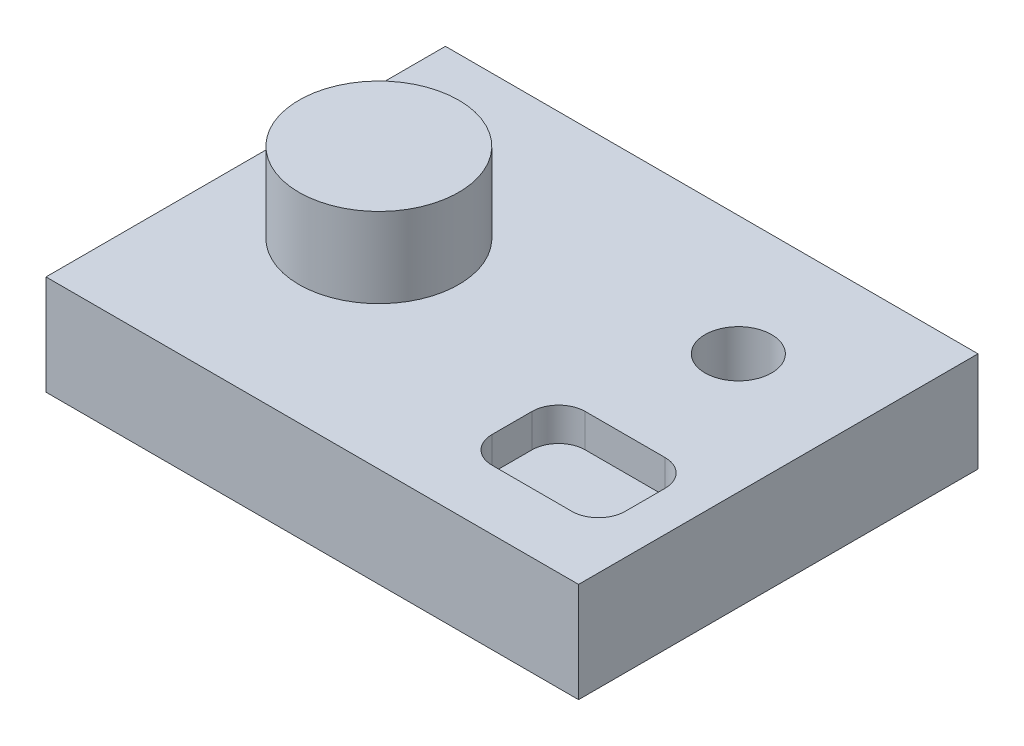
from build123d import *

# Parameters (mm, degrees)
SKETCH1_W           = 80
SKETCH1_H           = 60
BOSS_EXTRUDE1_DEPTH = 15
SKETCH2_R           = 12
BOSS_EXTRUDE2_DEPTH = 12
SKETCH3_R           = 5
CUT_EXTRUDE2_DEPTH  = 10
CUT_EXTRUDE4_DEPTH  = 5


with BuildPart() as part:
    # Sketch1 → Boss-Extrude1 (new body)
    with BuildSketch(Plane(origin=(0, 0, 0), x_dir=(1, 0, 0), z_dir=(0, 1, 0))):
        Rectangle(SKETCH1_W, SKETCH1_H)
    extrude(amount=BOSS_EXTRUDE1_DEPTH)

    # Sketch2 → Boss-Extrude2 (add)
    with BuildSketch(Plane(origin=(0, 15, 0), x_dir=(1, 0, 0), z_dir=(0, 1, 0))):
        with Locations(Location((-20, 0, 0), (0, 0, 270))):
            Circle(SKETCH2_R)
    extrude(amount=BOSS_EXTRUDE2_DEPTH)

    # Sketch3 → Cut-Extrude2 (cut)
    with BuildSketch(Plane(origin=(0, 15, 0), x_dir=(1, 0, 0), z_dir=(0, 1, 0))):
        with Locations(Location((22, 12, 0), (0, 0, 270))):
            Circle(SKETCH3_R)
    extrude(amount=-CUT_EXTRUDE2_DEPTH, mode=Mode.SUBTRACT)

    # Sketch4 → Cut-Extrude4 (cut)
    with BuildSketch(Plane(origin=(0, 15, 0), x_dir=(1, 0, 0), z_dir=(0, 1, 0))):
        with BuildLine():
            Line((18, -21), (30, -21))
            ThreePointArc((30, -21), (32.828427125, -19.828427125), (34, -17))
            Line((34, -17), (34, -11))
            ThreePointArc((34, -11), (32.828427125, -8.171572875), (30, -7))
            Line((30, -7), (18, -7))
            ThreePointArc((18, -7), (15.171572875, -8.171572875), (14, -11))
            Line((14, -11), (14, -17))
            ThreePointArc((14, -17), (15.171572875, -19.828427125), (18, -21))
        make_face()
    extrude(amount=-CUT_EXTRUDE4_DEPTH, mode=Mode.SUBTRACT)


solid = part.part
